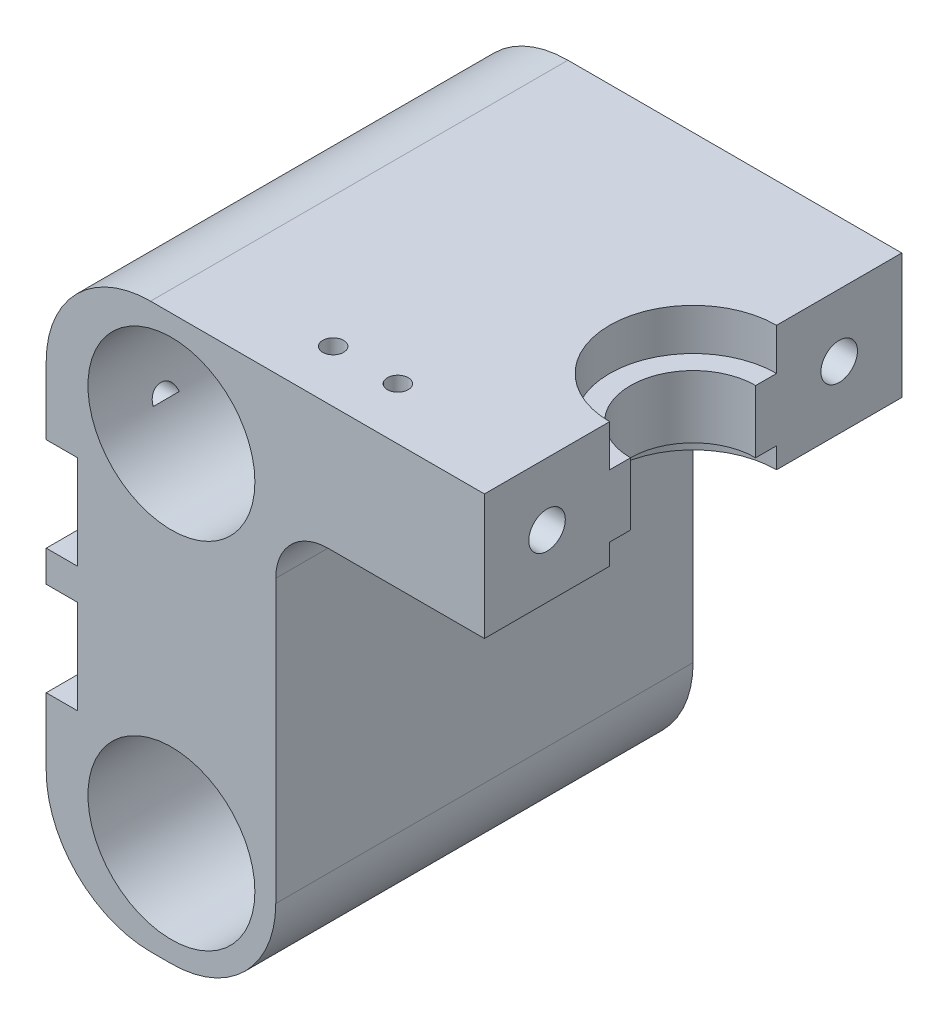
from build123d import *

# Parameters (mm, degrees)
SKETCH1_W           = 22
SKETCH1_H           = 54
SKETCH1_R           = 8
BOSS_EXTRUDE1_DEPTH = 40
SKETCH2_W           = 48
SKETCH2_H           = 21
CUT_EXTRUDE1_DEPTH  = 3
SKETCH6_W           = 40
SKETCH6_H           = 12
BOSS_EXTRUDE2_DEPTH = 20
SKETCH7_R           = 8
CUT_EXTRUDE5_DEPTH  = 4
CUT_EXTRUDE6_START  = -10
SKETCH7_2_R         = 8
CUT_EXTRUDE6_DEPTH  = 3
SKETCH8_R           = 6
CUT_EXTRUDE7_DEPTH  = 7
SKETCH9_R           = 1.75
CUT_EXTRUDE8_DEPTH  = 15
SKETCH10_R          = 1.25
CUT_EXTRUDE9_DEPTH  = 5
SKETCH13_R          = 1.25
CUT_EXTRUDE10_DEPTH = 10
BOSS_EXTRUDE3_START = 3
SKETCH14_W          = 40
SKETCH14_H          = 3
SKETCH14_R          = 1.25
BOSS_EXTRUDE3_DEPTH = 3
FILLET1_R           = 10
FILLET2_R           = 5
SKETCH15_R          = 1
CUT_EXTRUDE11_DEPTH = 10


with BuildPart() as part:
    # Sketch1 → Boss-Extrude1 (new body)
    with BuildSketch(Plane.XY):
        with Locations((11, 27)):
            Rectangle(SKETCH1_W, SKETCH1_H)
        with Locations((12, 10)):
            Circle(SKETCH1_R, mode=Mode.SUBTRACT)
        with Locations((12, 44)):
            Circle(SKETCH1_R, mode=Mode.SUBTRACT)
    extrude(amount=BOSS_EXTRUDE1_DEPTH)

    # Sketch2 → Cut-Extrude1 (cut)
    with BuildSketch(Plane.ZY):
        with Locations((24, 27)):
            Rectangle(SKETCH2_W, SKETCH2_H)
    extrude(amount=-CUT_EXTRUDE1_DEPTH, mode=Mode.SUBTRACT)

    # Sketch6 → Boss-Extrude2 (add)
    with BuildSketch(Plane(origin=(22, 0, 0), x_dir=(0, 0, -1), z_dir=(1, 0, 0))):
        with Locations((-20, 48)):
            Rectangle(SKETCH6_W, SKETCH6_H)
    extrude(amount=BOSS_EXTRUDE2_DEPTH)

    # Sketch7 → Cut-Extrude5 (cut)
    with BuildSketch(Plane(origin=(0, 54, 0), x_dir=(1, 0, 0), z_dir=(0, 1, 0))):
        with Locations((42, -20)):
            Circle(SKETCH7_R)
    extrude(amount=-CUT_EXTRUDE5_DEPTH, mode=Mode.SUBTRACT)

    # Sketch7<2> → Cut-Extrude6 (cut)
    with BuildSketch(Plane(origin=(0, 54, 0), x_dir=(1, 0, 0), z_dir=(0, 1, 0)).offset(CUT_EXTRUDE6_START)):
        with Locations((42, -20)):
            Circle(SKETCH7_2_R)
    extrude(amount=-CUT_EXTRUDE6_DEPTH, mode=Mode.SUBTRACT)

    # Sketch8 → Cut-Extrude7 (cut)
    with BuildSketch(Plane(origin=(0, 50, 0), x_dir=(1, 0, 0), z_dir=(0, 1, 0))):
        with Locations((42, -20)):
            Circle(SKETCH8_R)
    extrude(amount=-CUT_EXTRUDE7_DEPTH, mode=Mode.SUBTRACT)

    # Sketch9 → Cut-Extrude8 (cut)
    with BuildSketch(Plane(origin=(42, 0, 0), x_dir=(0, 0, -1), z_dir=(1, 0, 0))):
        with Locations((-34, 48)):
            Circle(SKETCH9_R)
        with Locations((-6, 48)):
            Circle(SKETCH9_R)
    extrude(amount=-CUT_EXTRUDE8_DEPTH, mode=Mode.SUBTRACT)

    # Sketch10 → Cut-Extrude9 (cut)
    with BuildSketch(Plane.ZY):
        with Locations((33.5, 40)):
            Circle(SKETCH10_R)
        with Locations((33.5, 14)):
            Circle(SKETCH10_R)
        with Locations((6.5, 14)):
            Circle(SKETCH10_R)
        with Locations((6.5, 40)):
            Circle(SKETCH10_R)
        with Locations((15, 40)):
            Circle(SKETCH10_R)
        with Locations((25, 40)):
            Circle(SKETCH10_R)
        with Locations((15, 14)):
            Circle(SKETCH10_R)
        with Locations((25, 14)):
            Circle(SKETCH10_R)
    extrude(amount=-CUT_EXTRUDE9_DEPTH, mode=Mode.SUBTRACT)

    # Sketch13 → Cut-Extrude10 (cut)
    with BuildSketch(Plane.ZY):
        with Locations((6.5, 27)):
            Circle(SKETCH13_R)
        with Locations((33.5, 27)):
            Circle(SKETCH13_R)
    extrude(amount=-CUT_EXTRUDE10_DEPTH, mode=Mode.SUBTRACT)

    # Sketch14 → Boss-Extrude3 (add)
    with BuildSketch(Plane.ZY.offset(-3).offset(BOSS_EXTRUDE3_START)):
        with Locations((20, 27)):
            Rectangle(SKETCH14_W, SKETCH14_H)
        with Locations((6.5, 27)):
            Circle(SKETCH14_R, mode=Mode.SUBTRACT)
        with Locations((33.5, 27)):
            Circle(SKETCH14_R, mode=Mode.SUBTRACT)
    extrude(amount=-BOSS_EXTRUDE3_DEPTH)

    # Fillet1
    fillet1_edges = [part.edges().sort_by_distance(p)[0] for p in [
        (0, 54, 20),
        (22, 0, 20),
        (0, 0, 20),
    ]]
    fillet(fillet1_edges, radius=FILLET1_R)

    # Fillet2
    fillet2_edges = [part.edges().sort_by_distance(p)[0] for p in [
        (22, 42, 20),
    ]]
    fillet(fillet2_edges, radius=FILLET2_R)

    # Sketch15 → Cut-Extrude11 (cut)
    with BuildSketch(Plane(origin=(0, 54, 0), x_dir=(1, 0, 0), z_dir=(0, 1, 0))):
        with Locations(Location((22.5, -35, 0), (0, 0, 180))):
            Circle(SKETCH15_R)
        with Locations(Location((28.7, -35, 0), (0, 0, 180))):
            Circle(SKETCH15_R)
    extrude(amount=-CUT_EXTRUDE11_DEPTH, mode=Mode.SUBTRACT)


solid = part.part
